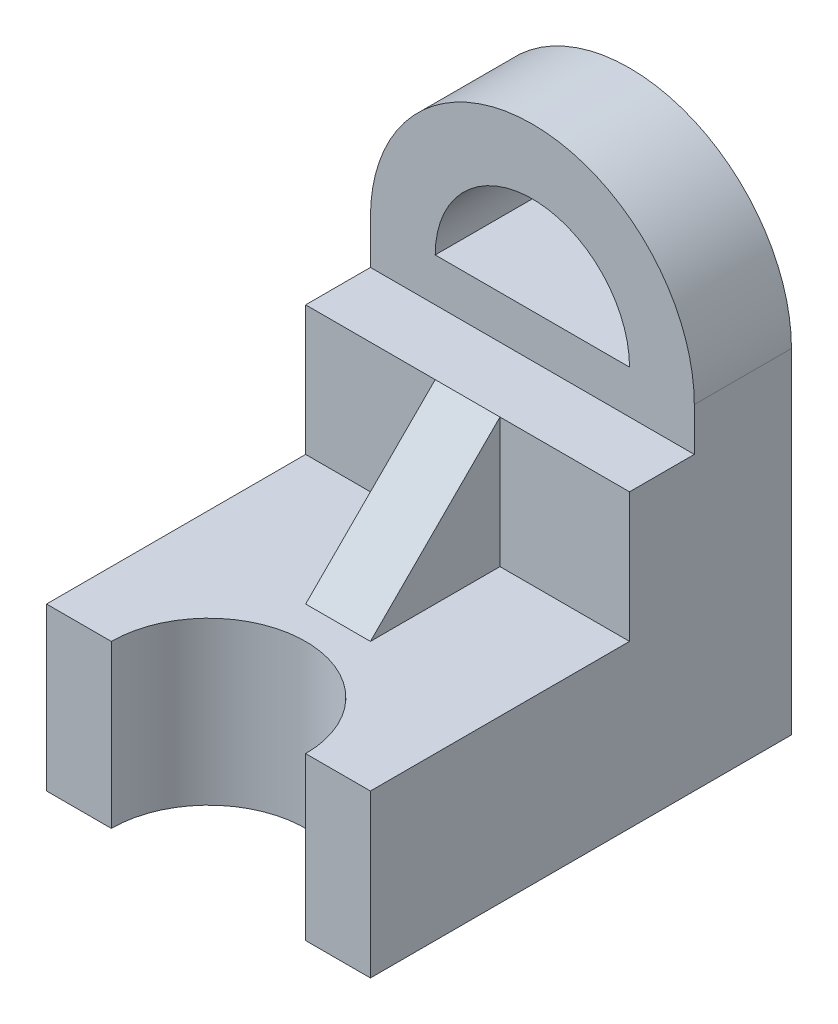
from build123d import *

# Parameters (mm, degrees)
SKETCH1_W           = 90
SKETCH1_H           = 45
BOSS_EXTRUDE1_DEPTH = 117
SKETCH1_3_W         = 90
SKETCH1_3_H         = 36
BOSS_EXTRUDE2_DEPTH = 45
BOSS_EXTRUDE3_DEPTH = 27
RIB2_REACH          = 188.435
SKETCH2_WALL_W      = 425.781638764
SKETCH2_WALL_H      = 18
CUT_EXTRUDE1_REACH  = 158.087
SKETCH3_R           = 27


with BuildPart() as part:
    # Sketch1 → Boss-Extrude1 (new body)
    with BuildSketch(Plane.XY):
        with Locations((0, 22.5)):
            Rectangle(SKETCH1_W, SKETCH1_H)
    extrude(amount=BOSS_EXTRUDE1_DEPTH)

    # Sketch1<3> → Boss-Extrude2 (add)
    with BuildSketch(Plane.XY):
        with Locations((0, 63)):
            Rectangle(SKETCH1_3_W, SKETCH1_3_H)
    extrude(amount=BOSS_EXTRUDE2_DEPTH)

    # Sketch1<4> → Boss-Extrude3 (add)
    with BuildSketch(Plane.XY):
        with BuildLine():
            Line((-45, 93), (-45, 81))
            Line((-45, 81), (45, 81))
            Line((45, 81), (45, 93))
            ThreePointArc((45, 93), (0, 138), (-45, 93))
        make_face()
        with BuildLine():
            Line((27, 93), (-27, 93))
            ThreePointArc((-27, 93), (0, 120), (27, 93))
        make_face(mode=Mode.SUBTRACT)
    extrude(amount=BOSS_EXTRUDE3_DEPTH)

    # Sketch2 wall → Rib2 (add, up to next)
    with BuildSketch(Plane(origin=(0, 63, 63), x_dir=(0, -0.707106781187, 0.707106781187), z_dir=(0, -0.707106781187, -0.707106781187)), mode=Mode.PRIVATE) as rib2_sk1:
        Rectangle(SKETCH2_WALL_W, SKETCH2_WALL_H)
    rib2_tool1 = extrude(rib2_sk1.sketch, amount=RIB2_REACH, mode=Mode.PRIVATE) - part.part
    add(rib2_tool1.solids().sort_by_distance((0, 63, 63))[0])

    # Sketch3 → Cut-Extrude1 (cut, up to next)
    with BuildSketch(Plane(origin=(0, 45, 0), x_dir=(1, 0, 0), z_dir=(0, 1, 0)), mode=Mode.PRIVATE) as cut_extrude1_sk1:
        with Locations((0, -117)):
            Circle(SKETCH3_R)
    cut_extrude1_tool1 = extrude(cut_extrude1_sk1.sketch, amount=-CUT_EXTRUDE1_REACH, mode=Mode.PRIVATE) & part.part
    add(cut_extrude1_tool1.solids().sort_by_distance((0, 45, 117))[0], mode=Mode.SUBTRACT)


solid = part.part
